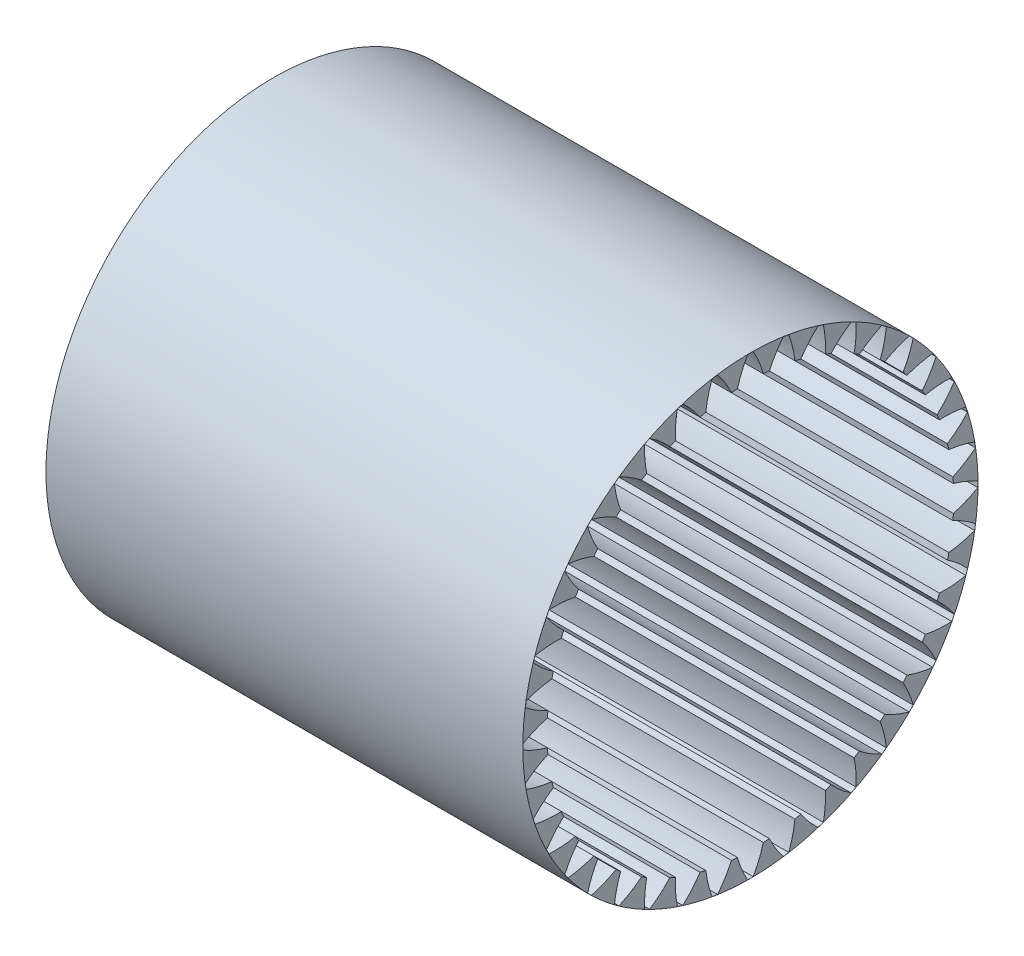
from build123d import *

# Parameters (mm, degrees)
BASPROSKE_W     = 89.093699553
BASPROSKE_H     = 4.5264
TOOTHCUT_DEPTH  = 108.492682049
TEETHCUTS_COUNT = 40
TEETHCUTS_ANGLE = 351
SCALE1_SCALE    = 0.399751684


with BuildPart() as part:
    # BasProSke → Base-Revolve (revolve)
    with BuildSketch(Plane(origin=(0, 0, 0), x_dir=(1, 0, 0), z_dir=(0, 1, 0)), mode=Mode.PRIVATE) as base_revolve_sk:
        with Locations((44.546849777, 40.2632)):
            Rectangle(BASPROSKE_W, BASPROSKE_H)
    revolve(base_revolve_sk.sketch.rotate(Axis((-10, 0, 0), (1, 0, 0)), 180), axis=Axis((-10, 0, 0), (1, 0, 0)))

    # TooCutSke → ToothCut (cut, through all)
    with BuildSketch(Plane(origin=(0, 0, 0), x_dir=(0, 0, -1), z_dir=(1, 0, 0))):
        with BuildLine():
            ThreePointArc((2.427265626, 37.896947459), (1.618641911, 40.256878641), (0.522524415, 42.497787816))
            ThreePointArc((0.522524415, 42.497787816), (0, 42.501), (-0.522524415, 42.497787816))
            ThreePointArc((-0.522524415, 42.497787816), (-1.618641911, 40.256878641), (-2.427265626, 37.896947459))
            ThreePointArc((-2.427265626, 37.896947459), (0, 37.9746), (2.427265626, 37.896947459))
        make_face()
    toothcut = extrude(amount=TOOTHCUT_DEPTH, mode=Mode.SUBTRACT)

    # TeethCuts: ToothCut ×40 about axis
    teethcuts_axis = Axis((-10, 0, 0), (1, 0, 0))
    for i in range(1, TEETHCUTS_COUNT):
        add(toothcut.rotate(teethcuts_axis, i * TEETHCUTS_ANGLE / (TEETHCUTS_COUNT - 1)), mode=Mode.SUBTRACT)


with BuildPart() as part_1:
    # Scale1: scaled about (44.546849777, 0, 0)
    add(part.part.scale(SCALE1_SCALE).moved(Location((26.739171577, 0, 0))))


solid = part_1.part
